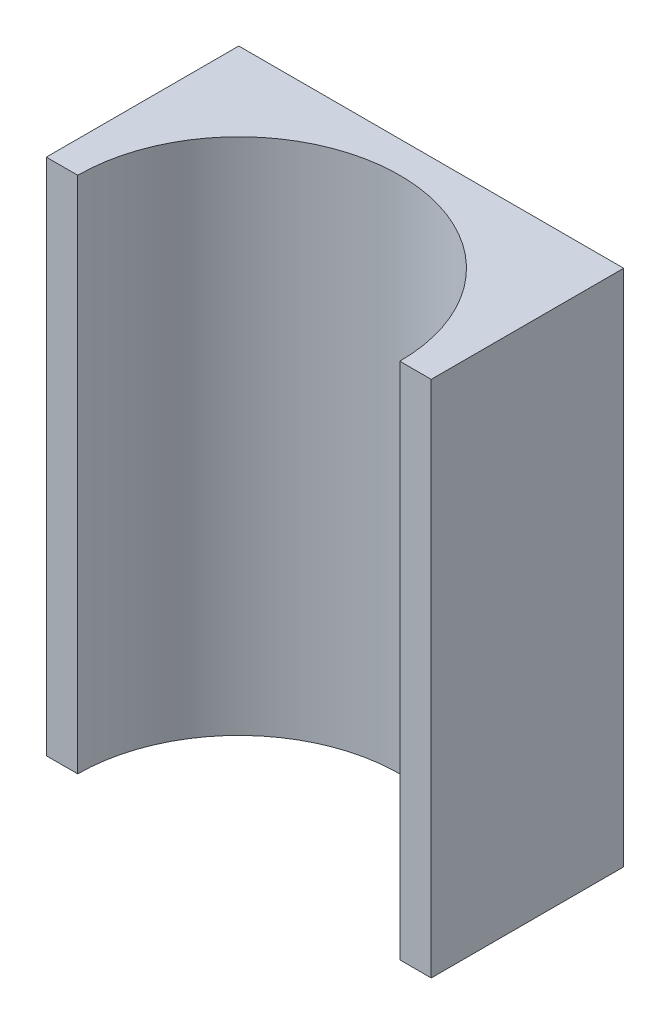
from build123d import *

# Parameters (mm, degrees)
BOSS_EXTRUDE1_DEPTH = 3352.8


with BuildPart() as part:
    # Sketch1 → Boss-Extrude1 (new body)
    with BuildSketch(Plane(origin=(0, 0, 0), x_dir=(1, 0, 0), z_dir=(0, 1, 0))):
        with BuildLine():
            Line((-1244.6, 0), (-1041.4, 0))
            ThreePointArc((-1041.4, 0), (0, 1041.4), (1041.4, 0))
            Line((1041.4, 0), (1244.6, 0))
            Line((1244.6, 0), (1244.6, 1244.6))
            Line((1244.6, 1244.6), (0, 1244.6))
            Line((0, 1244.6), (-1244.6, 1244.6))
            Line((-1244.6, 1244.6), (-1244.6, 0))
        make_face()
    extrude(amount=BOSS_EXTRUDE1_DEPTH)


solid = part.part
